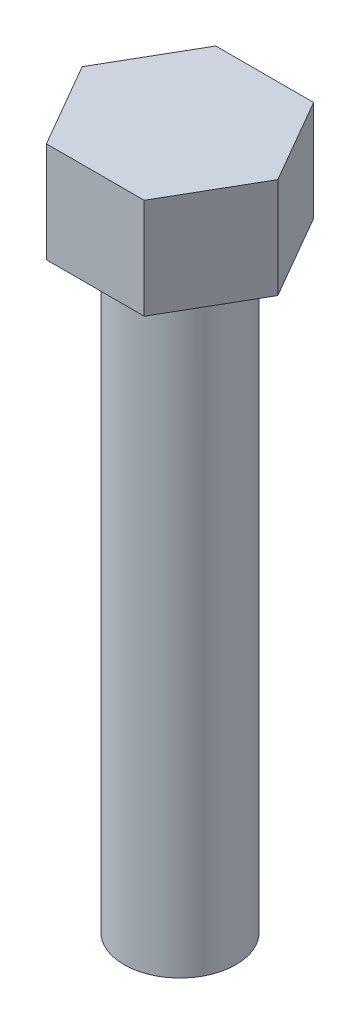
from build123d import *

# Parameters (mm, degrees)
BOSS_EXTRUDE1_DEPTH = 4.8
SKETCH3_R           = 2.675
BOSS_EXTRUDE2_DEPTH = 28.7
FILLET1_R           = 0.25


with BuildPart() as part:
    # Sketch2 → Boss-Extrude1 (new body)
    with BuildSketch(Plane(origin=(0, 0, 0), x_dir=(1, 0, 0), z_dir=(0, 1, 0))):
        Polygon((-2.3375, 4.048668763), (-4.675, 0), (-2.3375, -4.048668763), (2.3375, -4.048668763), (4.675, 0), (2.3375, 4.048668763), align=None)
    extrude(amount=BOSS_EXTRUDE1_DEPTH)

    # Sketch3 → Boss-Extrude2 (add)
    with BuildSketch(Plane.XZ):
        with Locations(Location((0, 0, 0), (0, 0, 270))):
            Circle(SKETCH3_R)
    extrude(amount=BOSS_EXTRUDE2_DEPTH)

    # Fillet1
    fillet1_edges = [part.edges().sort_by_distance(p)[0] for p in [
        (0, 0, 2.675),
    ]]
    fillet(fillet1_edges, radius=FILLET1_R)


solid = part.part
